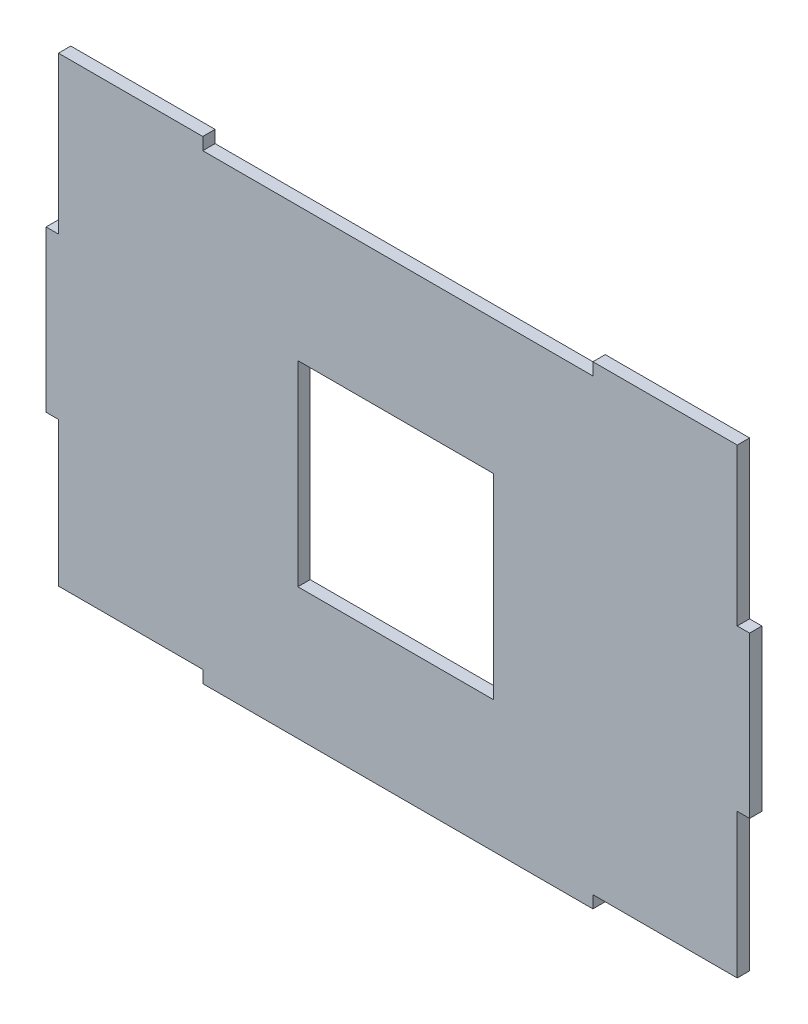
from build123d import *

# Parameters (mm, degrees)
SKETCH1_W           = 31.75
SKETCH1_H           = 31.75
BOSS_EXTRUDE1_DEPTH = 2


with BuildPart() as part:
    # Sketch1 → Boss-Extrude1 (new body)
    with BuildSketch(Plane.XY):
        Polygon((-31.623, -39.356725313), (31.623, -39.356725313), (31.623, -37.356725313), (55.023, -37.356725313), (55.023, -13.956725313), (57.023, -13.956725313), (57.023, 12.065), (55.023, 12.065), (55.023, 35.465), (55.023, 37.465), (31.623, 37.465), (31.623, 35.465), (-31.623, 35.465), (-31.623, 37.465), (-55.023, 37.465), (-55.023, 35.465), (-55.023, 12.065), (-57.023, 12.065), (-57.023, -13.956725313), (-55.023, -13.956725313), (-55.023, -37.356725313), (-31.623, -37.356725313), align=None)
        with Locations((-0.333916733, -2.169108116)):
            Rectangle(SKETCH1_W, SKETCH1_H, mode=Mode.SUBTRACT)
    extrude(amount=BOSS_EXTRUDE1_DEPTH)


solid = part.part
